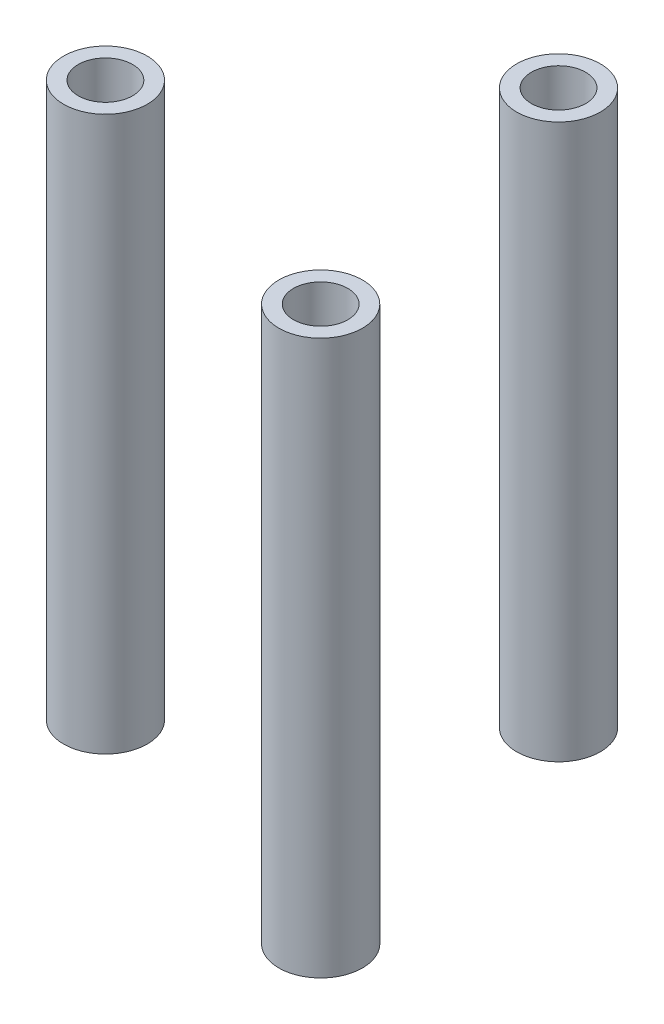
from build123d import *

# Parameters (mm, degrees)
SKETCH1_R             = 4
SKETCH1_R_2           = 2.6
BOSS_EXTRUDE1_DEPTH   = 53
BOSS_EXTRUDE1_2_DEPTH = 53
BOSS_EXTRUDE1_3_DEPTH = 53


with BuildPart() as part:
    # Sketch1 → Boss-Extrude1 (new body)
    with BuildSketch(Plane(origin=(0, 0, 0), x_dir=(1, 0, 0), z_dir=(0, 1, 0))):
        with Locations(Location((-16.87435593, -4.445066022, 0), (0, 0, 270))):
            Circle(SKETCH1_R)
        with Locations(Location((-16.87435593, -4.445066022, 0), (0, 0, 270))):
            Circle(SKETCH1_R_2, mode=Mode.SUBTRACT)
    extrude(amount=BOSS_EXTRUDE1_DEPTH)


with BuildPart() as body_2:
    # Sketch1 → Boss-Extrude1 2 (new body)
    with BuildSketch(Plane(origin=(0, 0, 0), x_dir=(1, 0, 0), z_dir=(0, 1, 0))):
        with Locations(Location((11.967713002, -12.69946241, 0), (0, 0, 270))):
            Circle(SKETCH1_R)
        with Locations(Location((11.967713002, -12.69946241, 0), (0, 0, 270))):
            Circle(SKETCH1_R_2, mode=Mode.SUBTRACT)
    extrude(amount=BOSS_EXTRUDE1_2_DEPTH)


with BuildPart() as body_3:
    # Sketch1 → Boss-Extrude1 3 (new body)
    with BuildSketch(Plane(origin=(0, 0, 0), x_dir=(1, 0, 0), z_dir=(0, 1, 0))):
        with Locations(Location((5.437521602, 16.58118991, 0), (0, 0, 270))):
            Circle(SKETCH1_R)
        with Locations(Location((5.437521602, 16.58118991, 0), (0, 0, 270))):
            Circle(SKETCH1_R_2, mode=Mode.SUBTRACT)
    extrude(amount=BOSS_EXTRUDE1_3_DEPTH)


solid = Compound([part.part, body_2.part, body_3.part])
